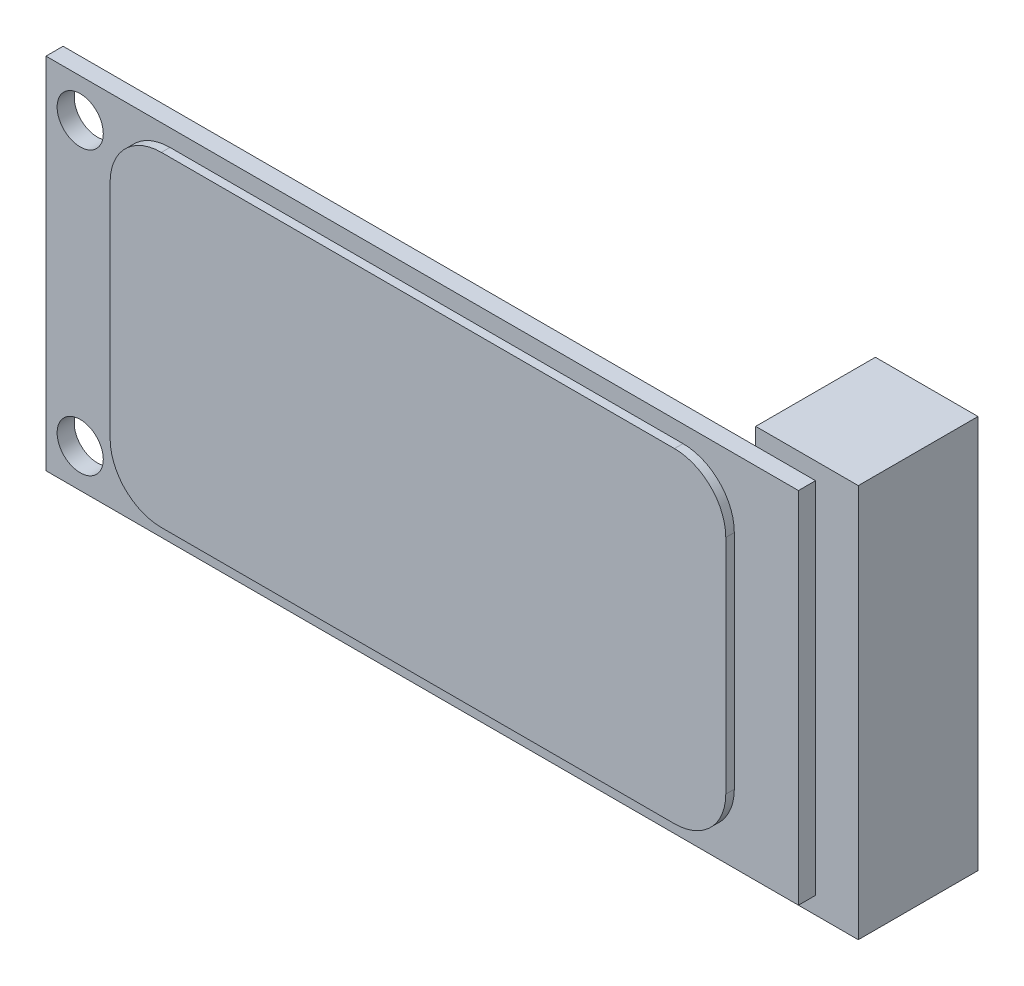
from build123d import *

# Parameters (mm, degrees)
SKETCH1_W           = 44
SKETCH1_H           = 21
SKETCH1_R           = 1.35
BOSS_EXTRUDE1_DEPTH = 1
SKETCH2_W           = 36
SKETCH2_H           = 19
BOSS_EXTRUDE2_DEPTH = 0.5
FILLET1_R           = 3
SKETCH3_W           = 6
SKETCH3_H           = 23
BOSS_EXTRUDE3_DEPTH = 7


with BuildPart() as part:
    # Sketch1 → Boss-Extrude1 (new body)
    with BuildSketch(Plane.XY):
        Rectangle(SKETCH1_W, SKETCH1_H)
        with Locations((-20, 8.25)):
            Circle(SKETCH1_R, mode=Mode.SUBTRACT)
        with Locations((-20, -8.25)):
            Circle(SKETCH1_R, mode=Mode.SUBTRACT)
    extrude(amount=BOSS_EXTRUDE1_DEPTH)

    # Sketch2 → Boss-Extrude2 (add)
    with BuildSketch(Plane.XY.offset(1)):
        with Locations((0.25, 0)):
            Rectangle(SKETCH2_W, SKETCH2_H)
    extrude(amount=BOSS_EXTRUDE2_DEPTH)

    # Fillet1
    fillet1_edges = [part.edges().sort_by_distance(p)[0] for p in [
        (18.25, 9.5, 1.25),
        (-17.75, 9.5, 1.25),
        (-17.75, -9.5, 1.25),
        (18.25, -9.5, 1.25),
    ]]
    fillet(fillet1_edges, radius=FILLET1_R)

    # Sketch3 → Boss-Extrude3 (add)
    with BuildSketch(Plane(origin=(0, 0, 0), x_dir=(-1, 0, 0), z_dir=(0, 0, -1))):
        with Locations((-21.5, 0)):
            Rectangle(SKETCH3_W, SKETCH3_H)
    extrude(amount=BOSS_EXTRUDE3_DEPTH)


solid = part.part
